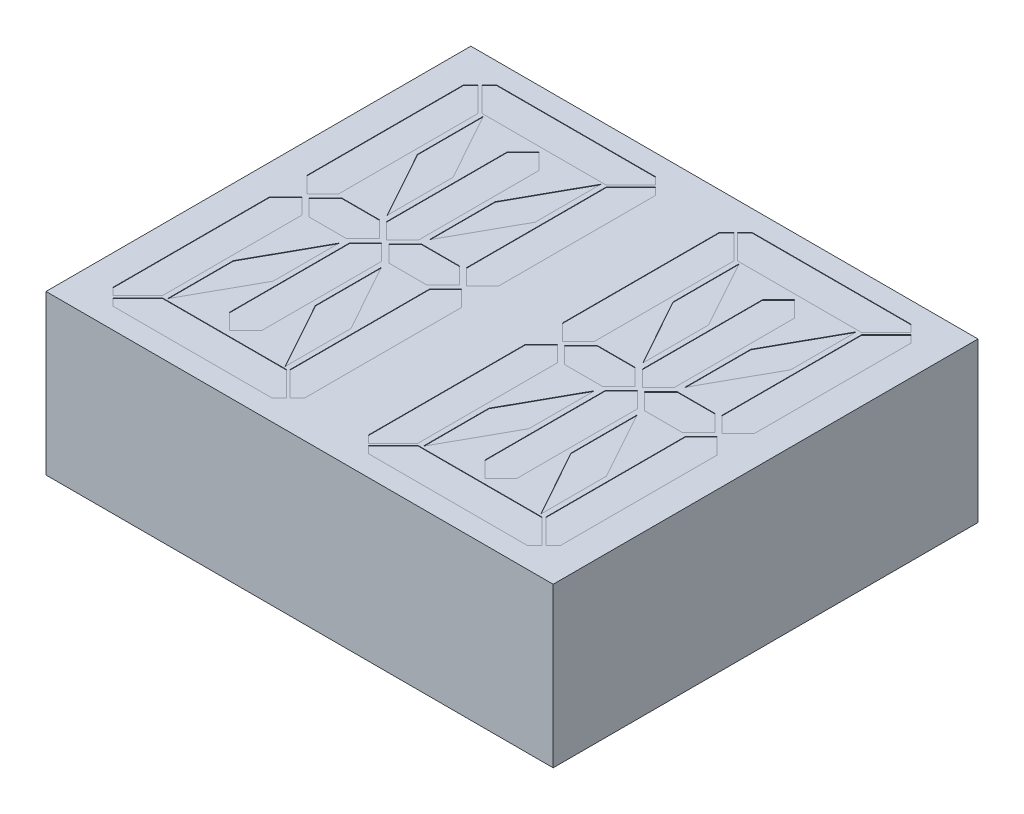
from build123d import *

# Parameters (mm, degrees)
SKETCH1_W           = 25.1968
SKETCH1_H           = 21.1074
BOSS_EXTRUDE1_DEPTH = 7.8994
CUT_EXTRUDE1_DEPTH  = 0.0254


with BuildPart() as part:
    # Sketch1 → Boss-Extrude1 (new body)
    with BuildSketch(Plane(origin=(0, 0, 0), x_dir=(1, 0, 0), z_dir=(0, 1, 0))):
        Rectangle(SKETCH1_W, SKETCH1_H)
    extrude(amount=BOSS_EXTRUDE1_DEPTH)

    # Sketch2 → Cut-Extrude1 (cut)
    with BuildSketch(Plane(origin=(0, 7.8994, 0), x_dir=(1, 0, 0), z_dir=(0, 1, 0))):
        Polygon((-11.1125, 0.92075), (-11.1125, 8.716776949), (-10.753289755, 9.075987194), (-9.525, 7.847697439), (-9.525, 0.92075), (-10.31875, 0.127), align=None)
        Polygon((-9.435197439, 7.9375), (-10.663487194, 9.165789755), (-10.304276949, 9.525), (-2.395723051, 9.525), (-2.036512806, 9.165789755), (-3.264802561, 7.9375), align=None)
        Polygon((-6.35, 7.6835), (-7.14375, 6.88975), (-7.14375, 0.92075), (-6.35, 0.127), (-5.55625, 0.92075), (-5.55625, 6.88975), align=None)
        Polygon((-10.086539755, 0), (-9.271, 0.815539755), (-7.39775, 0.815539755), (-6.582210245, 0), (-7.39775, -0.815539755), (-9.271, -0.815539755), align=None)
        Polygon((-9.271, 7.847697439), (-9.271, 4.572766625), (-7.39775, 1.192727616), (-7.39775, 4.46765843), align=None)
        Polygon((-5.30225, 4.46765843), (-3.429, 7.847697439), (-3.429, 4.572766625), (-5.30225, 1.192727616), align=None)
        Polygon((-5.30225, 0.815539755), (-6.117789755, 0), (-5.30225, -0.815539755), (-3.429, -0.815539755), (-2.613460245, 0), (-3.429, 0.815539755), align=None)
        Polygon((-2.38125, 0.127), (-1.5875, 0.92075), (-1.5875, 8.716776949), (-1.946710245, 9.075987194), (-3.175, 7.847697439), (-3.175, 0.92075), align=None)
        Polygon((-1.5875, -0.92075), (-1.5875, -8.716776949), (-1.946710245, -9.075987194), (-3.175, -7.847697439), (-3.175, -0.92075), (-2.38125, -0.127), align=None)
        Polygon((-3.264802561, -7.9375), (-2.036512806, -9.165789755), (-2.395723051, -9.525), (-10.304276949, -9.525), (-10.663487194, -9.165789755), (-9.435197439, -7.9375), align=None)
        Polygon((-6.35, -7.6835), (-5.55625, -6.88975), (-5.55625, -0.92075), (-6.35, -0.127), (-7.14375, -0.92075), (-7.14375, -6.88975), align=None)
        Polygon((-3.429, -7.847697439), (-3.429, -4.572766625), (-5.30225, -1.192727616), (-5.30225, -4.46765843), align=None)
        Polygon((-7.39775, -4.46765843), (-9.271, -7.847697439), (-9.271, -4.572766625), (-7.39775, -1.192727616), align=None)
        Polygon((-10.31875, -0.127), (-11.1125, -0.92075), (-11.1125, -8.716776949), (-10.753289755, -9.075987194), (-9.525, -7.847697439), (-9.525, -0.92075), align=None)
    cut_extrude1 = extrude(amount=-CUT_EXTRUDE1_DEPTH, mode=Mode.SUBTRACT)

    # Mirror1: Cut-Extrude1 across plane
    add(cut_extrude1.mirror(Plane(origin=(0, 0, 0), x_dir=(0, 0, 1), z_dir=(1, 0, 0))), mode=Mode.SUBTRACT)


solid = part.part
